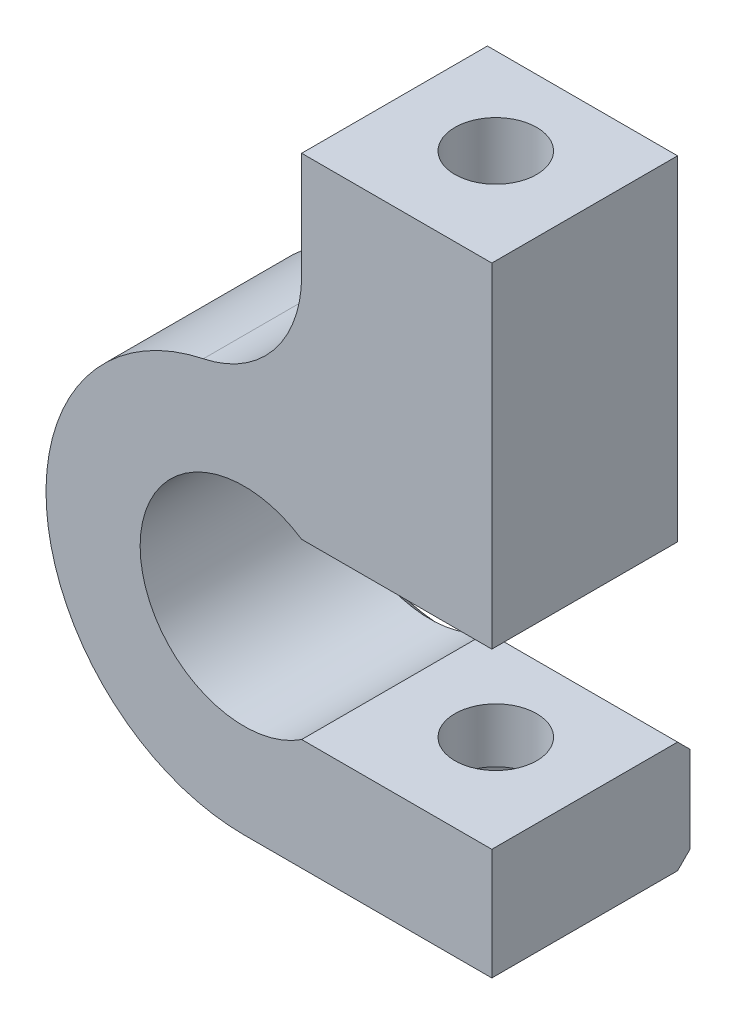
from build123d import *

# Parameters (mm, degrees)
BOSS_EXTRUDE1_DEPTH = 8
SKETCH2_R           = 1.65
CUT_EXTRUDE1_DEPTH  = 21.493901532
CUT_EXTRUDE2_DEPTH  = 2.3
SKETCH4_W           = 7.678362647
SKETCH4_H           = 8
SKETCH4_R           = 1.65
BOSS_EXTRUDE2_DEPTH = 13.5
FILLET1_R           = 5
CHAMFER1_SIZE       = 0.5


with BuildPart() as part:
    # Sketch1 → Boss-Extrude1 (new body)
    with BuildSketch(Plane.XY):
        with BuildLine():
            Line((0, 8), (10, 8))
            Line((10, 8), (10, 3.5))
            Line((10, 3.5), (2.321637353, 3.5))
            ThreePointArc((2.321637353, 3.5), (-4.2, 0), (2.321637353, -3.5))
            Line((2.321637353, -3.5), (10, -3.5))
            Line((10, -3.5), (10, -8))
            Line((10, -8), (0, -8))
            ThreePointArc((0, -8), (-8, 0), (0, 8))
        make_face()
    extrude(amount=BOSS_EXTRUDE1_DEPTH)

    # Sketch2 → Cut-Extrude1 (cut, through all)
    with BuildSketch(Plane.XZ.offset(8)):
        with Locations(Location((6.16, 4, 0), (0, 0, 270))):
            Circle(SKETCH2_R)
    extrude(amount=-CUT_EXTRUDE1_DEPTH, mode=Mode.SUBTRACT)

    # Sketch3 → Cut-Extrude2 (cut)
    with BuildSketch(Plane.XZ.offset(8)):
        Polygon((7.76, 6.771281292), (4.56, 6.771281292), (2.96, 4), (4.56, 1.228718708), (7.76, 1.228718708), (9.36, 4), align=None)
    extrude(amount=-CUT_EXTRUDE2_DEPTH, mode=Mode.SUBTRACT)

    # Sketch4 → Boss-Extrude2 (add)
    with BuildSketch(Plane.XZ.offset(-3.5)):
        with Locations((6.160818676, 4)):
            Rectangle(SKETCH4_W, SKETCH4_H)
        with Locations(Location((6.16, 4, 0), (0, 0, 270))):
            Circle(SKETCH4_R, mode=Mode.SUBTRACT)
    extrude(amount=-BOSS_EXTRUDE2_DEPTH)

    # Fillet1
    fillet1_edges = [part.edges().sort_by_distance(p)[0] for p in [
        (2.321637353, 8, 4),
    ]]
    fillet(fillet1_edges, radius=FILLET1_R)

    # Chamfer1
    chamfer1_edges = [part.edges().sort_by_distance(p)[0] for p in [
        (5, -8, 0),
        (-7.956976548, -0.828567563, 0),
        (1.204335989, 9.570758083, 0),
        (2.321637353, 14.860549771, 0),
        (6.160818677, 17, 0),
        (10, 10.25, 0),
        (6.160818677, 3.5, 0),
        (6.160818677, -3.5, 0),
        (-4.2, 0, 0),
    ]]
    chamfer(chamfer1_edges, length=CHAMFER1_SIZE)


solid = part.part
